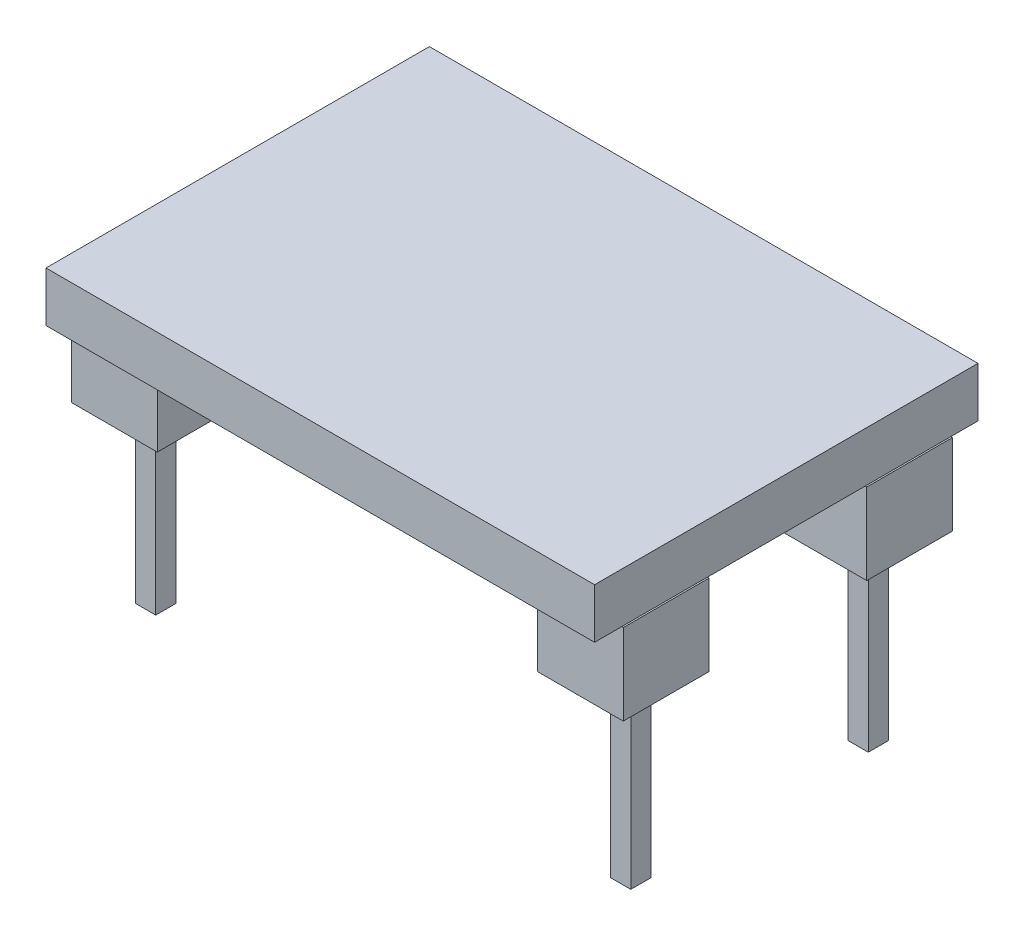
from build123d import *

# Parameters (mm, degrees)
SKETCH1_W           = 17.6
SKETCH1_H           = 12.3
BOSS_EXTRUDE1_DEPTH = 1.6
SKETCH2_W           = 2.75
SKETCH2_H           = 2.75
BOSS_EXTRUDE2_DEPTH = 2.6
SKETCH3_W           = 0.65
SKETCH3_H           = 0.65
BOSS_EXTRUDE3_DEPTH = 5.7


with BuildPart() as part:
    # Sketch1 → Boss-Extrude1 (new body)
    with BuildSketch(Plane(origin=(0, 0, 0), x_dir=(1, 0, 0), z_dir=(0, 1, 0))):
        Rectangle(SKETCH1_W, SKETCH1_H)
    extrude(amount=BOSS_EXTRUDE1_DEPTH)

    # Sketch2 → Boss-Extrude2 (add)
    with BuildSketch(Plane.XZ):
        with Locations((-7.475, 3.905)):
            Rectangle(SKETCH2_W, SKETCH2_H)
        with Locations((-7.475, -3.905)):
            Rectangle(SKETCH2_W, SKETCH2_H)
        with Locations((7.475, -3.905)):
            Rectangle(SKETCH2_W, SKETCH2_H)
        with Locations((7.475, 3.905)):
            Rectangle(SKETCH2_W, SKETCH2_H)
    extrude(amount=BOSS_EXTRUDE2_DEPTH)

    # Sketch3 → Boss-Extrude3 (add)
    with BuildSketch(Plane.XZ.offset(2.6)):
        with Locations((7.62, -3.81)):
            Rectangle(SKETCH3_W, SKETCH3_H)
        with Locations((7.62, 3.81)):
            Rectangle(SKETCH3_W, SKETCH3_H)
        with Locations((-7.62, -3.81)):
            Rectangle(SKETCH3_W, SKETCH3_H)
        with Locations((-7.62, 3.81)):
            Rectangle(SKETCH3_W, SKETCH3_H)
    extrude(amount=BOSS_EXTRUDE3_DEPTH)


solid = part.part
